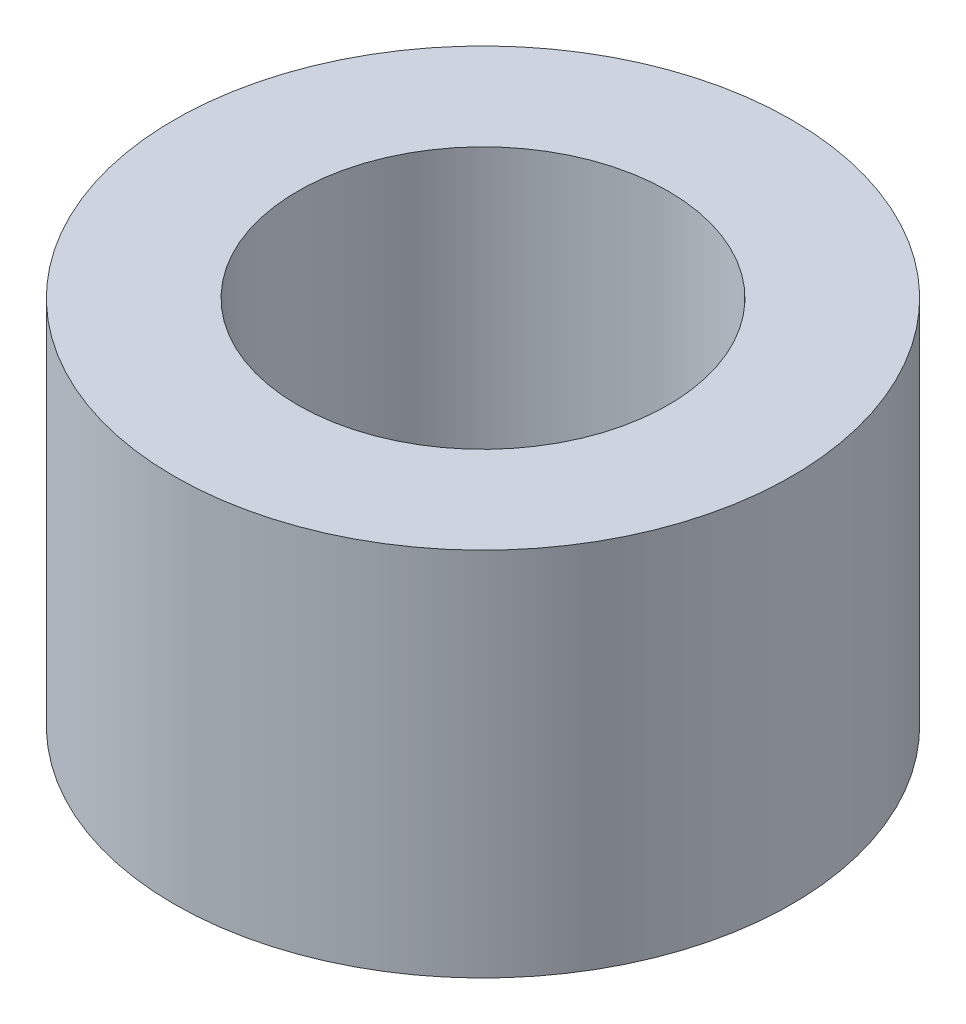
from build123d import *

# Parameters (mm, degrees)
SKETCH1_R           = 2.5
SKETCH1_R_2         = 1.5
BOSS_EXTRUDE1_DEPTH = 3


with BuildPart() as part:
    # Sketch1 → Boss-Extrude1 (new body)
    with BuildSketch(Plane(origin=(0, 0, 0), x_dir=(1, 0, 0), z_dir=(0, 1, 0))):
        with Locations(Location((0, 0, 0), (0, 0, 270))):
            Circle(SKETCH1_R)
        with Locations(Location((0, 0, 0), (0, 0, 270))):
            Circle(SKETCH1_R_2, mode=Mode.SUBTRACT)
    extrude(amount=BOSS_EXTRUDE1_DEPTH)


solid = part.part
